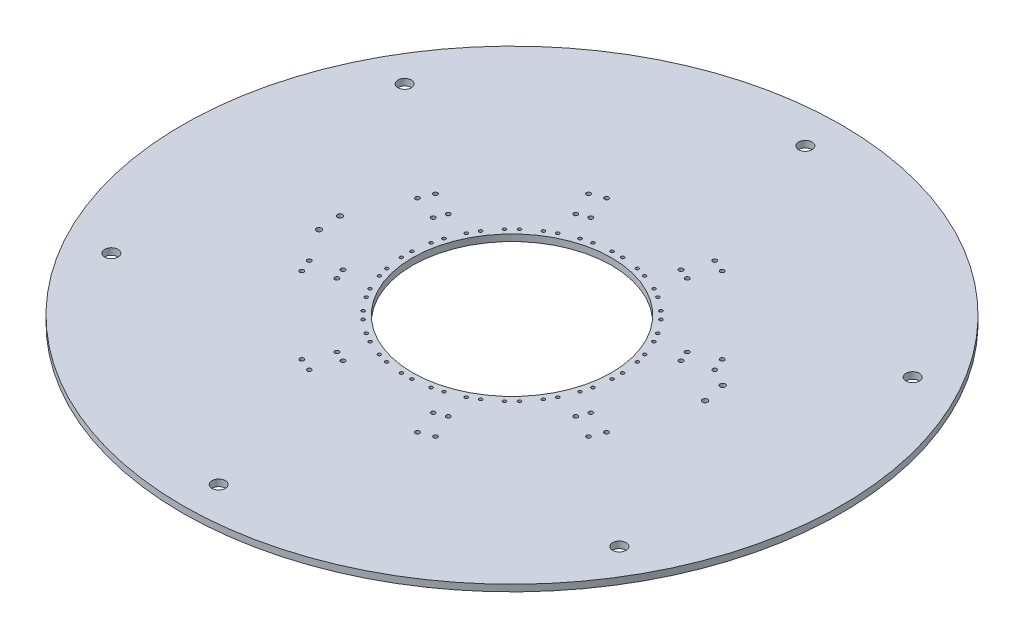
from build123d import *

# Parameters (mm, degrees)
SKETCH2_R           = 250
SKETCH2_R_2         = 5.1
SKETCH2_R_3         = 75.5
SKETCH2_R_4         = 1.25
SKETCH2_R_5         = 1.6
SKETCH2_R_6         = 2
BOSS_EXTRUDE1_DEPTH = 2.5


with BuildPart() as part:
    # Sketch2 → Boss-Extrude1 (new, symmetric)
    with BuildSketch(Plane(origin=(0, 0, 0), x_dir=(1, 0, 0), z_dir=(0, 1, 0))):
        with Locations(Location((0, 0, 0), (0, 0, 270))):
            Circle(SKETCH2_R)
        with Locations(Location((0, 222.5, 0), (0, 0, 270))):
            Circle(SKETCH2_R_2, mode=Mode.SUBTRACT)
        with Locations(Location((0, 0, 0), (0, 0, 270))):
            Circle(SKETCH2_R_3, mode=Mode.SUBTRACT)
        with Locations(Location((4, 79.899937422, 0), (0, 0, 270))):
            Circle(SKETCH2_R_4, mode=Mode.SUBTRACT)
        with Locations(Location((-4, 79.899937422, 0), (0, 0, 90))):
            Circle(SKETCH2_R_4, mode=Mode.SUBTRACT)
        with Locations(Location((16.815922202, 78.212689255, 0), (0, 0, 90))):
            Circle(SKETCH2_R_4, mode=Mode.SUBTRACT)
        with Locations(Location((24.543328812, 76.142136894, 0), (0, 0, 270))):
            Circle(SKETCH2_R_4, mode=Mode.SUBTRACT)
        with Locations(Location((36.485867096, 71.195375568, 0), (0, 0, 90))):
            Circle(SKETCH2_R_4, mode=Mode.SUBTRACT)
        with Locations(Location((43.414070326, 67.195375568, 0), (0, 0, 270))):
            Circle(SKETCH2_R_4, mode=Mode.SUBTRACT)
        with Locations(Location((53.669360443, 59.326214692, 0), (0, 0, 90))):
            Circle(SKETCH2_R_4, mode=Mode.SUBTRACT)
        with Locations(Location((59.326214692, 53.669360443, 0), (0, 0, 270))):
            Circle(SKETCH2_R_4, mode=Mode.SUBTRACT)
        with Locations(Location((67.195375568, 43.414070326, 0), (0, 0, 90))):
            Circle(SKETCH2_R_4, mode=Mode.SUBTRACT)
        with Locations(Location((71.195375568, 36.485867096, 0), (0, 0, 270))):
            Circle(SKETCH2_R_4, mode=Mode.SUBTRACT)
        with Locations(Location((76.142136894, 24.543328812, 0), (0, 0, 90))):
            Circle(SKETCH2_R_4, mode=Mode.SUBTRACT)
        with Locations(Location((78.212689255, 16.815922202, 0), (0, 0, 270))):
            Circle(SKETCH2_R_4, mode=Mode.SUBTRACT)
        with Locations(Location((79.899937422, 4, 0), (0, 0, 90))):
            Circle(SKETCH2_R_4, mode=Mode.SUBTRACT)
        with Locations(Location((79.899937422, -4, 0), (0, 0, 270))):
            Circle(SKETCH2_R_4, mode=Mode.SUBTRACT)
        with Locations(Location((78.212689255, -16.815922202, 0), (0, 0, 90))):
            Circle(SKETCH2_R_4, mode=Mode.SUBTRACT)
        with Locations(Location((76.142136894, -24.543328812, 0), (0, 0, 270))):
            Circle(SKETCH2_R_4, mode=Mode.SUBTRACT)
        with Locations(Location((192.690652342, 111.25, 0), (0, 0, 270))):
            Circle(SKETCH2_R_2, mode=Mode.SUBTRACT)
        with Locations(Location((192.690652342, -111.25, 0), (0, 0, 270))):
            Circle(SKETCH2_R_2, mode=Mode.SUBTRACT)
        with Locations(Location((0, -222.5, 0), (0, 0, 270))):
            Circle(SKETCH2_R_2, mode=Mode.SUBTRACT)
        with Locations(Location((-192.690652342, -111.25, 0), (0, 0, 270))):
            Circle(SKETCH2_R_2, mode=Mode.SUBTRACT)
        with Locations(Location((-192.690652342, 111.25, 0), (0, 0, 270))):
            Circle(SKETCH2_R_2, mode=Mode.SUBTRACT)
        with Locations(Location((-41.042417199, 112.763114494, 0), (0, 0, 270))):
            Circle(SKETCH2_R_5, mode=Mode.SUBTRACT)
        with Locations(Location((-34.202014333, 93.969262079, 0), (0, 0, 270))):
            Circle(SKETCH2_R_5, mode=Mode.SUBTRACT)
        with Locations(Location((41.042417199, 112.763114494, 0), (0, 0, 90))):
            Circle(SKETCH2_R_5, mode=Mode.SUBTRACT)
        with Locations(Location((34.202014333, 93.969262079, 0), (0, 0, 90))):
            Circle(SKETCH2_R_5, mode=Mode.SUBTRACT)
        with Locations(Location((90.630778704, 42.261826174, 0), (0, 0, 90))):
            Circle(SKETCH2_R_5, mode=Mode.SUBTRACT)
        with Locations(Location((42.261826174, 90.630778704, 0), (0, 0, 270))):
            Circle(SKETCH2_R_5, mode=Mode.SUBTRACT)
        with Locations(Location((50.714191409, 108.756934444, 0), (0, 0, 270))):
            Circle(SKETCH2_R_5, mode=Mode.SUBTRACT)
        with Locations(Location((108.756934444, 50.714191409, 0), (0, 0, 90))):
            Circle(SKETCH2_R_5, mode=Mode.SUBTRACT)
        with Locations(Location((93.969262079, -34.202014333, 0), (0, 0, 90))):
            Circle(SKETCH2_R_5, mode=Mode.SUBTRACT)
        with Locations(Location((93.969262079, 34.202014333, 0), (0, 0, 270))):
            Circle(SKETCH2_R_5, mode=Mode.SUBTRACT)
        with Locations(Location((112.763114494, 41.042417199, 0), (0, 0, 270))):
            Circle(SKETCH2_R_5, mode=Mode.SUBTRACT)
        with Locations(Location((112.763114494, -41.042417199, 0), (0, 0, 90))):
            Circle(SKETCH2_R_5, mode=Mode.SUBTRACT)
        with Locations(Location((42.261826174, -90.630778704, 0), (0, 0, 90))):
            Circle(SKETCH2_R_5, mode=Mode.SUBTRACT)
        with Locations(Location((90.630778704, -42.261826174, 0), (0, 0, 270))):
            Circle(SKETCH2_R_5, mode=Mode.SUBTRACT)
        with Locations(Location((108.756934444, -50.714191409, 0), (0, 0, 270))):
            Circle(SKETCH2_R_5, mode=Mode.SUBTRACT)
        with Locations(Location((50.714191409, -108.756934444, 0), (0, 0, 90))):
            Circle(SKETCH2_R_5, mode=Mode.SUBTRACT)
        with Locations(Location((-34.202014333, -93.969262079, 0), (0, 0, 90))):
            Circle(SKETCH2_R_5, mode=Mode.SUBTRACT)
        with Locations(Location((34.202014333, -93.969262079, 0), (0, 0, 270))):
            Circle(SKETCH2_R_5, mode=Mode.SUBTRACT)
        with Locations(Location((41.042417199, -112.763114494, 0), (0, 0, 270))):
            Circle(SKETCH2_R_5, mode=Mode.SUBTRACT)
        with Locations(Location((-41.042417199, -112.763114494, 0), (0, 0, 90))):
            Circle(SKETCH2_R_5, mode=Mode.SUBTRACT)
        with Locations(Location((-90.630778704, -42.261826174, 0), (0, 0, 90))):
            Circle(SKETCH2_R_5, mode=Mode.SUBTRACT)
        with Locations(Location((-42.261826174, -90.630778704, 0), (0, 0, 270))):
            Circle(SKETCH2_R_5, mode=Mode.SUBTRACT)
        with Locations(Location((-50.714191409, -108.756934444, 0), (0, 0, 270))):
            Circle(SKETCH2_R_5, mode=Mode.SUBTRACT)
        with Locations(Location((-108.756934444, -50.714191409, 0), (0, 0, 90))):
            Circle(SKETCH2_R_5, mode=Mode.SUBTRACT)
        with Locations(Location((-93.969262079, 34.202014333, 0), (0, 0, 90))):
            Circle(SKETCH2_R_5, mode=Mode.SUBTRACT)
        with Locations(Location((-93.969262079, -34.202014333, 0), (0, 0, 270))):
            Circle(SKETCH2_R_5, mode=Mode.SUBTRACT)
        with Locations(Location((-112.763114494, -41.042417199, 0), (0, 0, 270))):
            Circle(SKETCH2_R_5, mode=Mode.SUBTRACT)
        with Locations(Location((-112.763114494, 41.042417199, 0), (0, 0, 90))):
            Circle(SKETCH2_R_5, mode=Mode.SUBTRACT)
        with Locations(Location((-42.261826174, 90.630778704, 0), (0, 0, 90))):
            Circle(SKETCH2_R_5, mode=Mode.SUBTRACT)
        with Locations(Location((-90.630778704, 42.261826174, 0), (0, 0, 270))):
            Circle(SKETCH2_R_5, mode=Mode.SUBTRACT)
        with Locations(Location((-108.756934444, 50.714191409, 0), (0, 0, 270))):
            Circle(SKETCH2_R_5, mode=Mode.SUBTRACT)
        with Locations(Location((-50.714191409, 108.756934444, 0), (0, 0, 90))):
            Circle(SKETCH2_R_5, mode=Mode.SUBTRACT)
        with Locations(Location((71.195375568, -36.485867096, 0), (0, 0, 90))):
            Circle(SKETCH2_R_4, mode=Mode.SUBTRACT)
        with Locations(Location((67.195375568, -43.414070326, 0), (0, 0, 270))):
            Circle(SKETCH2_R_4, mode=Mode.SUBTRACT)
        with Locations(Location((59.326214692, -53.669360443, 0), (0, 0, 90))):
            Circle(SKETCH2_R_4, mode=Mode.SUBTRACT)
        with Locations(Location((53.669360443, -59.326214692, 0), (0, 0, 270))):
            Circle(SKETCH2_R_4, mode=Mode.SUBTRACT)
        with Locations(Location((43.414070326, -67.195375568, 0), (0, 0, 90))):
            Circle(SKETCH2_R_4, mode=Mode.SUBTRACT)
        with Locations(Location((36.485867096, -71.195375568, 0), (0, 0, 270))):
            Circle(SKETCH2_R_4, mode=Mode.SUBTRACT)
        with Locations(Location((24.543328812, -76.142136894, 0), (0, 0, 90))):
            Circle(SKETCH2_R_4, mode=Mode.SUBTRACT)
        with Locations(Location((16.815922202, -78.212689255, 0), (0, 0, 270))):
            Circle(SKETCH2_R_4, mode=Mode.SUBTRACT)
        with Locations(Location((4, -79.899937422, 0), (0, 0, 90))):
            Circle(SKETCH2_R_4, mode=Mode.SUBTRACT)
        with Locations(Location((-4, -79.899937422, 0), (0, 0, 270))):
            Circle(SKETCH2_R_4, mode=Mode.SUBTRACT)
        with Locations(Location((-16.815922202, -78.212689255, 0), (0, 0, 90))):
            Circle(SKETCH2_R_4, mode=Mode.SUBTRACT)
        with Locations(Location((-24.543328812, -76.142136894, 0), (0, 0, 270))):
            Circle(SKETCH2_R_4, mode=Mode.SUBTRACT)
        with Locations(Location((-36.485867096, -71.195375568, 0), (0, 0, 90))):
            Circle(SKETCH2_R_4, mode=Mode.SUBTRACT)
        with Locations(Location((-43.414070326, -67.195375568, 0), (0, 0, 270))):
            Circle(SKETCH2_R_4, mode=Mode.SUBTRACT)
        with Locations(Location((-53.669360442, -59.326214692, 0), (0, 0, 90))):
            Circle(SKETCH2_R_4, mode=Mode.SUBTRACT)
        with Locations(Location((-59.326214692, -53.669360443, 0), (0, 0, 270))):
            Circle(SKETCH2_R_4, mode=Mode.SUBTRACT)
        with Locations(Location((-67.195375568, -43.414070326, 0), (0, 0, 90))):
            Circle(SKETCH2_R_4, mode=Mode.SUBTRACT)
        with Locations(Location((-71.195375568, -36.485867096, 0), (0, 0, 270))):
            Circle(SKETCH2_R_4, mode=Mode.SUBTRACT)
        with Locations(Location((-76.142136894, -24.543328812, 0), (0, 0, 90))):
            Circle(SKETCH2_R_4, mode=Mode.SUBTRACT)
        with Locations(Location((-78.212689255, -16.815922202, 0), (0, 0, 270))):
            Circle(SKETCH2_R_4, mode=Mode.SUBTRACT)
        with Locations(Location((-79.899937422, -4, 0), (0, 0, 90))):
            Circle(SKETCH2_R_4, mode=Mode.SUBTRACT)
        with Locations(Location((-79.899937422, 4, 0), (0, 0, 270))):
            Circle(SKETCH2_R_4, mode=Mode.SUBTRACT)
        with Locations(Location((-78.212689255, 16.815922202, 0), (0, 0, 90))):
            Circle(SKETCH2_R_4, mode=Mode.SUBTRACT)
        with Locations(Location((-76.142136894, 24.543328812, 0), (0, 0, 270))):
            Circle(SKETCH2_R_4, mode=Mode.SUBTRACT)
        with Locations(Location((-71.195375568, 36.485867096, 0), (0, 0, 90))):
            Circle(SKETCH2_R_4, mode=Mode.SUBTRACT)
        with Locations(Location((-67.195375568, 43.414070326, 0), (0, 0, 270))):
            Circle(SKETCH2_R_4, mode=Mode.SUBTRACT)
        with Locations(Location((-59.326214692, 53.669360443, 0), (0, 0, 90))):
            Circle(SKETCH2_R_4, mode=Mode.SUBTRACT)
        with Locations(Location((-53.669360443, 59.326214692, 0), (0, 0, 270))):
            Circle(SKETCH2_R_4, mode=Mode.SUBTRACT)
        with Locations(Location((-43.414070326, 67.195375568, 0), (0, 0, 90))):
            Circle(SKETCH2_R_4, mode=Mode.SUBTRACT)
        with Locations(Location((-36.485867096, 71.195375568, 0), (0, 0, 270))):
            Circle(SKETCH2_R_4, mode=Mode.SUBTRACT)
        with Locations(Location((-24.543328812, 76.142136894, 0), (0, 0, 90))):
            Circle(SKETCH2_R_4, mode=Mode.SUBTRACT)
        with Locations(Location((-16.815922202, 78.212689255, 0), (0, 0, 270))):
            Circle(SKETCH2_R_4, mode=Mode.SUBTRACT)
        with Locations(Location((-129.383554409, -17.033668085, 0), (0, 0, 270))):
            Circle(SKETCH2_R_6, mode=Mode.SUBTRACT)
        with Locations(Location((-130.5, 0, 0), (0, 0, 270))):
            Circle(SKETCH2_R_6, mode=Mode.SUBTRACT)
        with Locations(Location((129.383554409, 17.033668085, 0), (0, 0, 90))):
            Circle(SKETCH2_R_6, mode=Mode.SUBTRACT)
        with Locations(Location((126.053320331, 33.775885386, 0), (0, 0, 90))):
            Circle(SKETCH2_R_6, mode=Mode.SUBTRACT)
    extrude(amount=BOSS_EXTRUDE1_DEPTH, both=True)


solid = part.part
